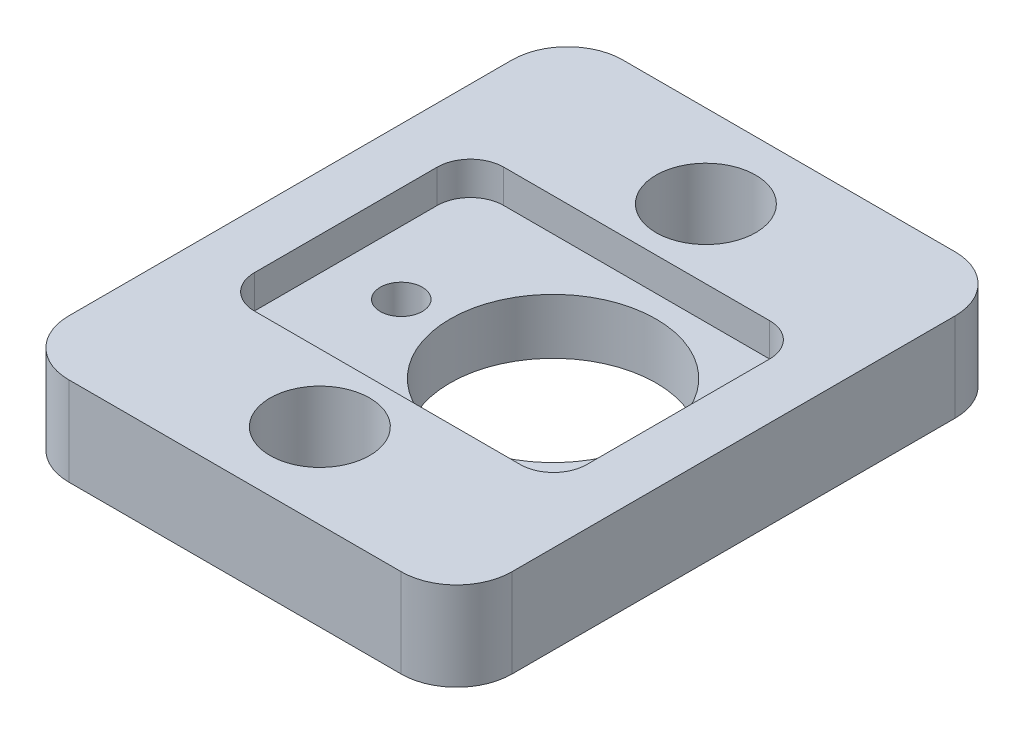
from build123d import *

# Parameters (mm, degrees)
BOSS_EXTRUDE1_DEPTH = 3.2
CUT_EXTRUDE1_DEPTH  = 1.2
SKETCH3_R           = 3.72
CUT_EXTRUDE2_DEPTH  = 26.690465157
SKETCH4_R           = 1.8
CUT_EXTRUDE3_DEPTH  = 26.811625288
SKETCH5_R           = 0.76
CUT_EXTRUDE4_DEPTH  = 10


with BuildPart() as part:
    # Sketch1 → Boss-Extrude1 (new body)
    with BuildSketch(Plane(origin=(0, 0, 0), x_dir=(1, 0, 0), z_dir=(0, 1, 0))):
        with BuildLine():
            Line((2, 0), (14, 0))
            ThreePointArc((14, 0), (15.414213562, -0.585786438), (16, -2))
            Line((16, -2), (16, -18))
            ThreePointArc((16, -18), (15.414213562, -19.414213562), (14, -20))
            Line((14, -20), (2, -20))
            ThreePointArc((2, -20), (0.585786438, -19.414213562), (0, -18))
            Line((0, -18), (0, -2))
            ThreePointArc((0, -2), (0.585786438, -0.585786438), (2, 0))
        make_face()
    extrude(amount=BOSS_EXTRUDE1_DEPTH)

    # Sketch2 → Cut-Extrude1 (cut)
    with BuildSketch(Plane(origin=(0, 3.2, 0), x_dir=(1, 0, 0), z_dir=(0, 1, 0))):
        with BuildLine():
            Line((3.2, -5.5), (12.8, -5.5))
            ThreePointArc((12.8, -5.5), (13.648528137, -5.851471863), (14, -6.7))
            Line((14, -6.7), (14, -13.3))
            ThreePointArc((14, -13.3), (13.648528137, -14.148528137), (12.8, -14.5))
            Line((12.8, -14.5), (3.2, -14.5))
            ThreePointArc((3.2, -14.5), (2.351471863, -14.148528137), (2, -13.3))
            Line((2, -13.3), (2, -6.7))
            ThreePointArc((2, -6.7), (2.351471863, -5.851471863), (3.2, -5.5))
        make_face()
    extrude(amount=-CUT_EXTRUDE1_DEPTH, mode=Mode.SUBTRACT)

    # Sketch3 → Cut-Extrude2 (cut, through all)
    with BuildSketch(Plane(origin=(0, 2, 0), x_dir=(1, 0, 0), z_dir=(0, 1, 0))):
        with Locations(Location((9.5, -10.0173545, 0), (0, 0, 270))):
            Circle(SKETCH3_R)
    extrude(amount=-CUT_EXTRUDE2_DEPTH, mode=Mode.SUBTRACT)

    # Sketch4 → Cut-Extrude3 (cut, through all)
    with BuildSketch(Plane(origin=(0, 3.2, 0), x_dir=(1, 0, 0), z_dir=(0, 1, 0))):
        with Locations(Location((8, -3, 0), (0, 0, 270))):
            Circle(SKETCH4_R)
        with Locations(Location((8, -16.936566923, 0), (0, 0, 90))):
            Circle(SKETCH4_R)
    extrude(amount=-CUT_EXTRUDE3_DEPTH, mode=Mode.SUBTRACT)

    # Sketch5 → Cut-Extrude4 (cut)
    with BuildSketch(Plane(origin=(0, 2, 0), x_dir=(1, 0, 0), z_dir=(0, 1, 0))):
        with Locations(Location((4.286808808, -10.283883288, 0), (0, 0, 270))):
            Circle(SKETCH5_R)
    extrude(amount=-CUT_EXTRUDE4_DEPTH, mode=Mode.SUBTRACT)


solid = part.part
